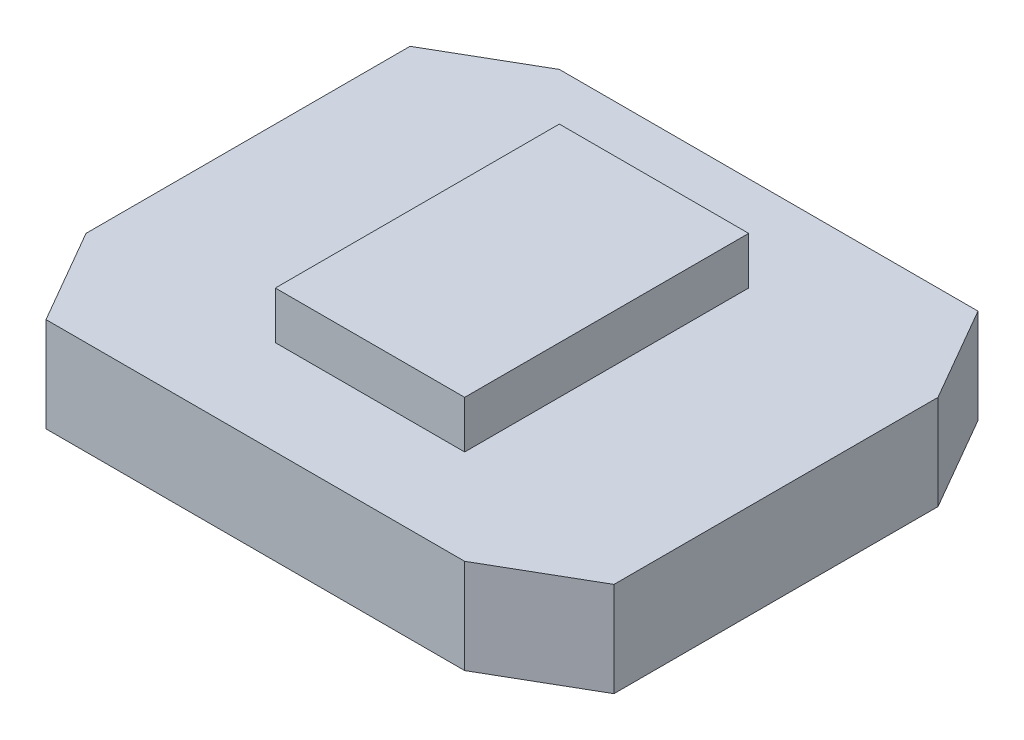
from build123d import *
from OCP.BRepFilletAPI import BRepFilletAPI_MakeChamfer

# Parameters (mm, degrees)
SKETCH1_W           = 60
SKETCH1_H           = 50
BOSS_EXTRUDE1_DEPTH = 15
CHAMFER1_SIZE       = 10
CHAMFER1_SIZE2      = 5.773502692
SKETCH2_W           = 20
SKETCH2_H           = 30
CUT_EXTRUDE1_DEPTH  = 5


with BuildPart() as part:
    # Sketch1 → Boss-Extrude1 (new body)
    with BuildSketch(Plane(origin=(0, 0, 0), x_dir=(1, 0, 0), z_dir=(0, 1, 0))):
        Rectangle(SKETCH1_W, SKETCH1_H)
    extrude(amount=BOSS_EXTRUDE1_DEPTH)

    # Chamfer1: one chamfer whose edges measure the first distance from different faces: ONE call of the kernel's chamfer builder (chamfer() names one face for all edges)
    chamfer1_edges_1 = [part.edges().sort_by_distance(p)[0] for p in [
        (30, 7.5, 25),
    ]]
    chamfer1_side_1 = [part.faces().sort_by_distance(p)[0] for p in [
        (0, 7.5, 25),
    ]]
    chamfer1_edges_2 = [part.edges().sort_by_distance(p)[0] for p in [
        (-30, 7.5, 25),
    ]]
    chamfer1_side_2 = [part.faces().sort_by_distance(p)[0] for p in [
        (-30, 7.5, 0),
    ]]
    chamfer1_edges_3 = [part.edges().sort_by_distance(p)[0] for p in [
        (-30, 7.5, -25),
    ]]
    chamfer1_side_3 = [part.faces().sort_by_distance(p)[0] for p in [
        (0, 7.5, -25),
    ]]
    chamfer1_edges_4 = [part.edges().sort_by_distance(p)[0] for p in [
        (30, 7.5, -25),
    ]]
    chamfer1_side_4 = [part.faces().sort_by_distance(p)[0] for p in [
        (30, 7.5, 0),
    ]]
    chamfer1 = BRepFilletAPI_MakeChamfer(part.part.solid().wrapped)
    for e in chamfer1_edges_1:
        chamfer1.Add(CHAMFER1_SIZE, CHAMFER1_SIZE2, e.wrapped, chamfer1_side_1[0].wrapped)  # the first distance lies on this face
    for e in chamfer1_edges_2:
        chamfer1.Add(CHAMFER1_SIZE, CHAMFER1_SIZE2, e.wrapped, chamfer1_side_2[0].wrapped)  # the first distance lies on this face
    for e in chamfer1_edges_3:
        chamfer1.Add(CHAMFER1_SIZE, CHAMFER1_SIZE2, e.wrapped, chamfer1_side_3[0].wrapped)  # the first distance lies on this face
    for e in chamfer1_edges_4:
        chamfer1.Add(CHAMFER1_SIZE, CHAMFER1_SIZE2, e.wrapped, chamfer1_side_4[0].wrapped)  # the first distance lies on this face
    add(Compound.cast(chamfer1.Shape()), mode=Mode.REPLACE)

    # Sketch2 → Cut-Extrude1 (cut)
    with BuildSketch(Plane(origin=(0, 15, 0), x_dir=(1, 0, 0), z_dir=(0, 1, 0))):
        Polygon((30, 15), (24.226497308, 25), (-20, 25), (-30, 19.226497308), (-30, -15), (-24.226497308, -25), (20, -25), (30, -19.226497308), align=None)
        Rectangle(SKETCH2_W, SKETCH2_H, mode=Mode.SUBTRACT)
    extrude(amount=-CUT_EXTRUDE1_DEPTH, mode=Mode.SUBTRACT)


solid = part.part
